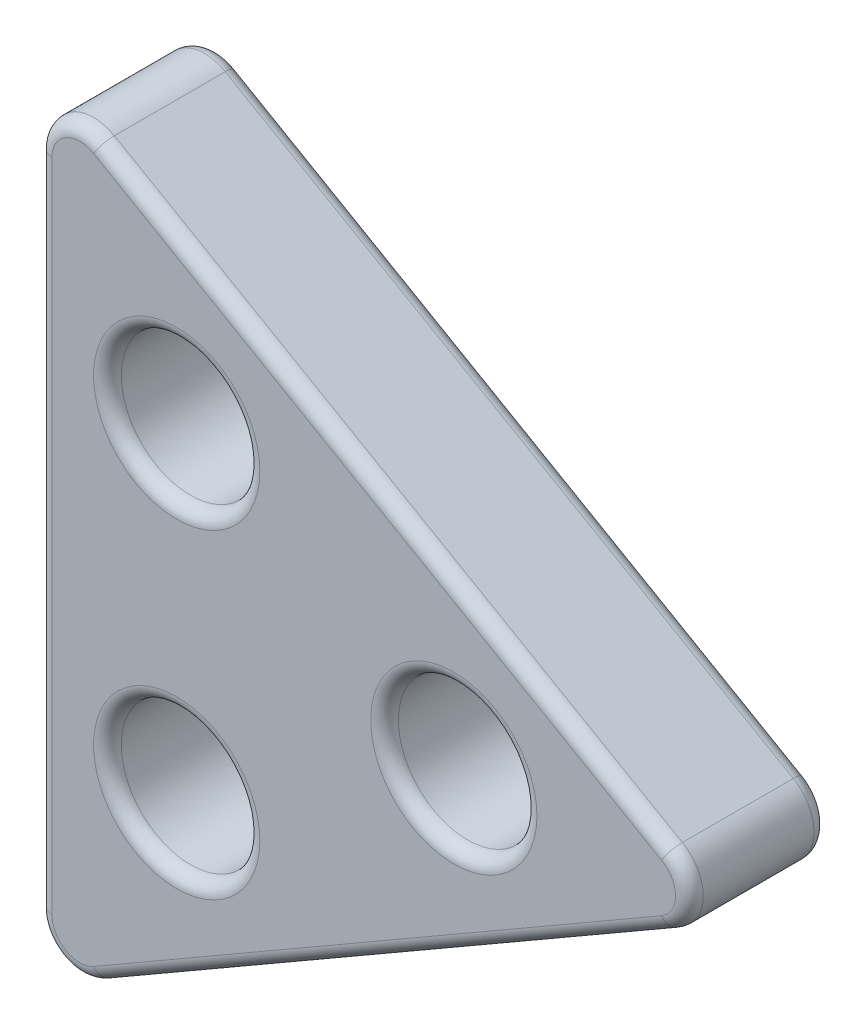
from build123d import *

# Parameters (mm, degrees)
BOSS_EXTRUDE1_DEPTH = 10
SKETCH2_R           = 5
CUT_EXTRUDE1_DEPTH  = 10
FILLET1_R           = 3
FILLET2_R           = 1


with BuildPart() as part:
    # Sketch1 → Boss-Extrude1 (new body)
    with BuildSketch(Plane.XY):
        Polygon((33.333333333, 0), (-16.666666667, 28.867513459), (-16.666666667, -28.867513459), align=None)
    extrude(amount=BOSS_EXTRUDE1_DEPTH)

    # Sketch2 → Cut-Extrude1 (cut)
    with BuildSketch(Plane(origin=(0, 0, 0), x_dir=(-1, 0, 0), z_dir=(0, 0, -1))):
        with Locations((6.666666667, 11.547005384)):
            Circle(SKETCH2_R)
        with Locations((6.666666667, -11.547005384)):
            Circle(SKETCH2_R)
        with Locations((-13.333333333, 0)):
            Circle(SKETCH2_R)
    extrude(amount=-CUT_EXTRUDE1_DEPTH, mode=Mode.SUBTRACT)

    # Fillet1
    fillet1_edges = [part.edges().sort_by_distance(p)[0] for p in [
        (-16.666666667, -28.867513459, 5),
        (-16.666666667, 28.867513459, 5),
        (33.333333333, 0, 5),
    ]]
    fillet(fillet1_edges, radius=FILLET1_R)

    # Fillet2
    fillet2_edges = [part.edges().sort_by_distance(p)[0] for p in [
        (-1.666666667, 11.547005384, 10),
        (-1.666666667, 11.547005384, 0),
        (-1.666666667, -11.547005384, 10),
        (-1.666666667, -11.547005384, 0),
        (18.333333333, 0, 10),
        (18.333333333, 0, 0),
        (-16.666666667, 0, 0),
        (-16.666666667, 0, 10),
        (8.333333333, -14.43375673, 0),
        (8.333333333, 14.43375673, 0),
        (-15.166666667, -26.269437248, 0),
        (30.333333333, 0, 0),
        (-15.166666667, 26.269437248, 0),
        (8.333333333, 14.43375673, 10),
        (8.333333333, -14.43375673, 10),
        (-15.166666667, -26.269437248, 10),
        (30.333333333, 0, 10),
        (-15.166666667, 26.269437248, 10),
    ]]
    fillet(fillet2_edges, radius=FILLET2_R)


solid = part.part
